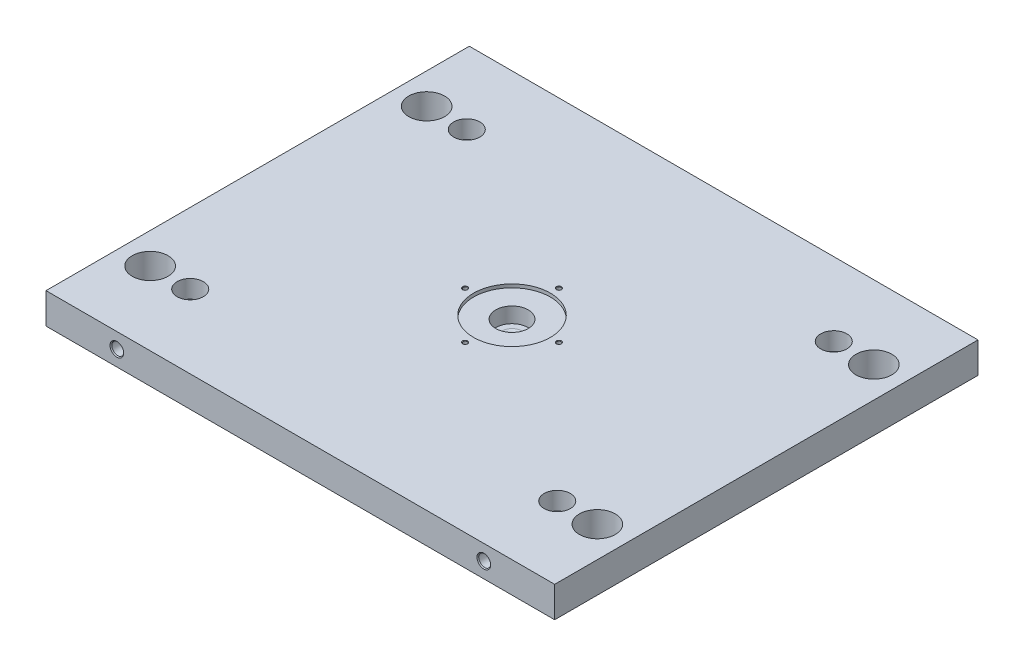
from build123d import *

# Parameters (mm, degrees)
SZKIC1_W                                           = 596
SZKIC1_H                                           = 496
SZKIC1_R                                           = 21
DODANIE_WYCI_GNI_CIE1_DEPTH                        = 36
SZKIC1_5_R                                         = 45
WYTNIJ_WYCI_GNI_CIE1_DEPTH                         = 4
POG_BIENIE_WALCOWE_POD_M16_WKR_T_Z_BEM_D           = 17.5
POG_BIENIE_WALCOWE_POD_M16_WKR_T_Z_BEM_CBORE_D     = 30.713
POG_BIENIE_WALCOWE_POD_M16_WKR_T_Z_BEM_CBORE_DEPTH = 21
SZKIC8_R                                           = 9
WYTNIJ_WYCI_GNI_CIE2_DEPTH                         = 777.05154468
SZKIC8_3_R                                         = 19
SZKIC8_3_R_2                                       = 9
WYTNIJ_WYCI_GNI_CIE3_DEPTH                         = 18
ZAOKR_GLENIE1_R                                    = 3
OTWORY_USTALAJ_CE_4_0MM1_D                         = 4
OTWORY_USTALAJ_CE_4_0MM1_DEPTH                     = 5
OTWORY_USTALAJ_CE_4_0MM1_TIP                       = 1.201721238
OTW_R_GWINTOWANY_M61_D                             = 5
OTW_R_GWINTOWANY_M61_DEPTH                         = 17
OTW_R_GWINTOWANY_M61_CSINK_D                       = 6.05
OTW_R_GWINTOWANY_M61_CSINK_ANGLE                   = 90
OTW_R_GWINTOWANY_M61_TIP                           = 1.502151548
OTW_R_GWINTOWANY_M161_D                            = 14
OTW_R_GWINTOWANY_M161_DEPTH                        = 42
OTW_R_GWINTOWANY_M161_CSINK_D                      = 16.05
OTW_R_GWINTOWANY_M161_CSINK_ANGLE                  = 90
OTW_R_GWINTOWANY_M161_TIP                          = 4.206024333


with BuildPart() as part:
    # Szkic1 → Dodanie-wyciągnięcie1 (new body)
    with BuildSketch(Plane(origin=(0, 0, 0), x_dir=(1, 0, 0), z_dir=(0, 1, 0))):
        with Locations((298, 248)):
            Rectangle(SZKIC1_W, SZKIC1_H)
        with Locations((36, 86)):
            Circle(SZKIC1_R, mode=Mode.SUBTRACT)
        with Locations((560, 86)):
            Circle(SZKIC1_R, mode=Mode.SUBTRACT)
        with Locations((36, 410)):
            Circle(SZKIC1_R, mode=Mode.SUBTRACT)
        with Locations((560, 410)):
            Circle(SZKIC1_R, mode=Mode.SUBTRACT)
    extrude(amount=-DODANIE_WYCI_GNI_CIE1_DEPTH)

    # Szkic1<5> → Wytnij-wyciągnięcie1 (cut)
    with BuildSketch(Plane(origin=(0, 0, 0), x_dir=(1, 0, 0), z_dir=(0, 1, 0))):
        with Locations((298, 248)):
            Circle(SZKIC1_5_R)
    extrude(amount=-WYTNIJ_WYCI_GNI_CIE1_DEPTH, mode=Mode.SUBTRACT)

    # Pogłębienie walcowe pod M16 Wkręt z łbem sześciokątnym z gniazdem2 (through all)
    with Locations(Plane(origin=(83, 0, -410), x_dir=(0, 0, 1), z_dir=(0, 1, 0))):
        with Locations((0, 0), (0, 430), (324, 430), (324, 0)):
            CounterBoreHole(POG_BIENIE_WALCOWE_POD_M16_WKR_T_Z_BEM_D / 2, POG_BIENIE_WALCOWE_POD_M16_WKR_T_Z_BEM_CBORE_D / 2, POG_BIENIE_WALCOWE_POD_M16_WKR_T_Z_BEM_CBORE_DEPTH)

    # Szkic8 → Wytnij-wyciągnięcie2 (cut, through all)
    with BuildSketch(Plane(origin=(0, -4, 0), x_dir=(1, 0, 0), z_dir=(0, 1, 0))):
        with Locations((298, 248)):
            Circle(SZKIC8_R)
    extrude(amount=-WYTNIJ_WYCI_GNI_CIE2_DEPTH, mode=Mode.SUBTRACT)

    # Szkic8<3> → Wytnij-wyciągnięcie3 (cut)
    with BuildSketch(Plane(origin=(0, -4, 0), x_dir=(1, 0, 0), z_dir=(0, 1, 0))):
        with Locations((298, 248)):
            Circle(SZKIC8_3_R)
        with Locations((298, 248)):
            Circle(SZKIC8_3_R_2, mode=Mode.SUBTRACT)
    extrude(amount=-WYTNIJ_WYCI_GNI_CIE3_DEPTH, mode=Mode.SUBTRACT)

    # Zaokrąglenie1
    zaokr_glenie1_edges = [part.edges().sort_by_distance(p)[0] for p in [
        (289, -22, -248),
    ]]
    fillet(zaokr_glenie1_edges, radius=ZAOKR_GLENIE1_R)

    # Otwory ustalające Ø4.0mm1
    with Locations(Plane(origin=(313, -22, -248), x_dir=(0, 0, 1), z_dir=(0, 1, 0))):
        with Locations((0, 0)):
            Hole(OTWORY_USTALAJ_CE_4_0MM1_D / 2, depth=OTWORY_USTALAJ_CE_4_0MM1_DEPTH)
            with Locations((0, 0, -(OTWORY_USTALAJ_CE_4_0MM1_DEPTH + OTWORY_USTALAJ_CE_4_0MM1_TIP / 2))):  # 118° drill point
                Cone(0, OTWORY_USTALAJ_CE_4_0MM1_D / 2, OTWORY_USTALAJ_CE_4_0MM1_TIP, mode=Mode.SUBTRACT)

    # Otwór gwintowany M61
    with Locations(Plane(origin=(243, 0, -248), x_dir=(0, 0, 1), z_dir=(0, 1, 0))):
        with Locations((0, 0), (-55, 55), (0, 110), (55, 55)):
            CounterSinkHole(OTW_R_GWINTOWANY_M61_D / 2, OTW_R_GWINTOWANY_M61_CSINK_D / 2, depth=OTW_R_GWINTOWANY_M61_DEPTH, counter_sink_angle=OTW_R_GWINTOWANY_M61_CSINK_ANGLE)
            with Locations((0, 0, -(OTW_R_GWINTOWANY_M61_DEPTH + OTW_R_GWINTOWANY_M61_TIP / 2))):  # 118° drill point
                Cone(0, OTW_R_GWINTOWANY_M61_D / 2, OTW_R_GWINTOWANY_M61_TIP, mode=Mode.SUBTRACT)

    # Otwór gwintowany M161
    with Locations(Plane(origin=(83, -18, 0), x_dir=(1, 0, 0), z_dir=(0, 0, 1))):
        with Locations((0, 0), (430, 0)):
            CounterSinkHole(OTW_R_GWINTOWANY_M161_D / 2, OTW_R_GWINTOWANY_M161_CSINK_D / 2, depth=OTW_R_GWINTOWANY_M161_DEPTH, counter_sink_angle=OTW_R_GWINTOWANY_M161_CSINK_ANGLE)
            with Locations((0, 0, -(OTW_R_GWINTOWANY_M161_DEPTH + OTW_R_GWINTOWANY_M161_TIP / 2))):  # 118° drill point
                Cone(0, OTW_R_GWINTOWANY_M161_D / 2, OTW_R_GWINTOWANY_M161_TIP, mode=Mode.SUBTRACT)


solid = part.part
